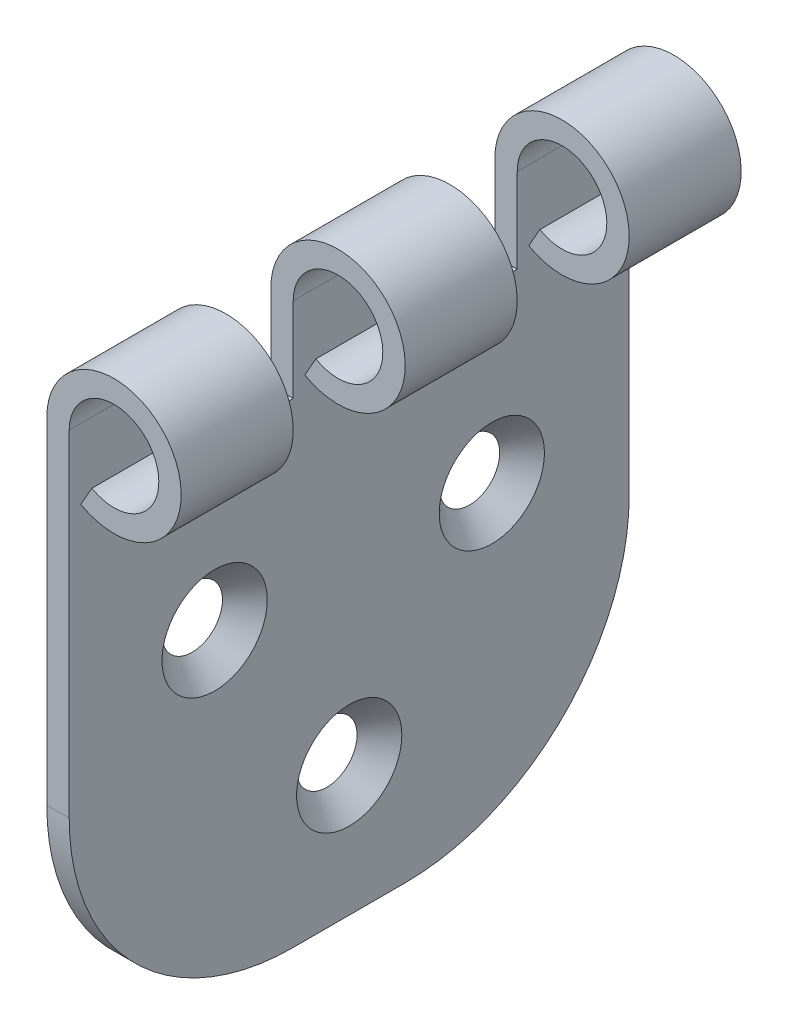
from build123d import *

# Parameters (mm, degrees)
BOSS_EXTRUDE1_DEPTH                          = 25
CUT_EXTRUDE1_DEPTH                           = 63.136945532
CUT_EXTRUDE1_DEPTH_BACK                      = 63.136945532
SKETCH2_W                                    = 10
SKETCH2_H                                    = 20.590421557
FILLET1_R                                    = 20
CSK_FOR_M4_COUNTERSUNK_FLAT_HEAD_SCR_2_COUNT = 2
CSK_FOR_M4_COUNTERSUNK_FLAT_HEAD_SCR_2_PITCH = 20.373860658
CSK_FOR_M4_COUNTERSUNK_FLAT_HEAD_SCR_3_COUNT = 2
CSK_FOR_M4_COUNTERSUNK_FLAT_HEAD_SCR_3_PITCH = 20.021215351


with BuildPart() as part:
    # Sketch1 → Boss-Extrude1 (new, symmetric)
    with BuildSketch(Plane.XY):
        with BuildLine():
            Line((0, 0), (0, 50))
            ThreePointArc((0, 50), (11.186683916, 53.016340491), (3.032769985, 44.785065097))
            Line((3.032769985, 44.785065097), (4.021846657, 46.523376732))
            ThreePointArc((4.021846657, 46.523376732), (9.457789277, 52.01089366), (2, 50))
            Line((2, 50), (2, 0))
            Line((2, 0), (0, 0))
        make_face()
    extrude(amount=BOSS_EXTRUDE1_DEPTH, both=True)

    # Sketch2 → Cut-Extrude1 (cut, two sides: drawn at the far end of the back side and taken through both)
    with BuildSketch(Plane(origin=(2, 0, 0), x_dir=(0, 0, -1), z_dir=(1, 0, 0)).offset(-CUT_EXTRUDE1_DEPTH_BACK)):
        with Locations((-10, 52.749880228)):
            Rectangle(SKETCH2_W, SKETCH2_H)
        with Locations((10, 52.749880228)):
            Rectangle(SKETCH2_W, SKETCH2_H)
    extrude(amount=CUT_EXTRUDE1_DEPTH + CUT_EXTRUDE1_DEPTH_BACK, mode=Mode.SUBTRACT)

    # Fillet1
    fillet1_edges = [part.edges().sort_by_distance(p)[0] for p in [
        (1, 0, 25),
        (1, 0, -25),
    ]]
    fillet(fillet1_edges, radius=FILLET1_R)

    # Sketch4 → CSK for M4 Countersunk Flat Head Screw1 (revolve, cut)
    with BuildSketch(Plane(origin=(2, 11.587467643, 0), x_dir=(0, 0, -1), z_dir=(0, 1, 0))):
        Polygon((0, 0), (0, 2), (2.25, 2), (2.25, 2.45), (4.7, 0), align=None)
    csk_for_m4_countersunk_flat_head_screw1 = revolve(axis=Axis((8.35, 11.587467643, 0), (-1, 0, 0)), mode=Mode.SUBTRACT)

    # CSK for M4 Countersunk Flat Head Scr 2: CSK for M4 Countersunk Flat Head Screw1 ×2
    with Locations(*[Vector(0, 0.8075197590977368, 0.5898405196887827) * (i * CSK_FOR_M4_COUNTERSUNK_FLAT_HEAD_SCR_2_PITCH) for i in range(1, CSK_FOR_M4_COUNTERSUNK_FLAT_HEAD_SCR_2_COUNT)]):
        add(csk_for_m4_countersunk_flat_head_screw1, mode=Mode.SUBTRACT)

    # CSK for M4 Countersunk Flat Head Scr 3: CSK for M4 Countersunk Flat Head Screw1 ×2
    with Locations(*[Vector(0, 0.7717239304738249, -0.6359576834460224) * (i * CSK_FOR_M4_COUNTERSUNK_FLAT_HEAD_SCR_3_PITCH) for i in range(1, CSK_FOR_M4_COUNTERSUNK_FLAT_HEAD_SCR_3_COUNT)]):
        add(csk_for_m4_countersunk_flat_head_screw1, mode=Mode.SUBTRACT)


solid = part.part
